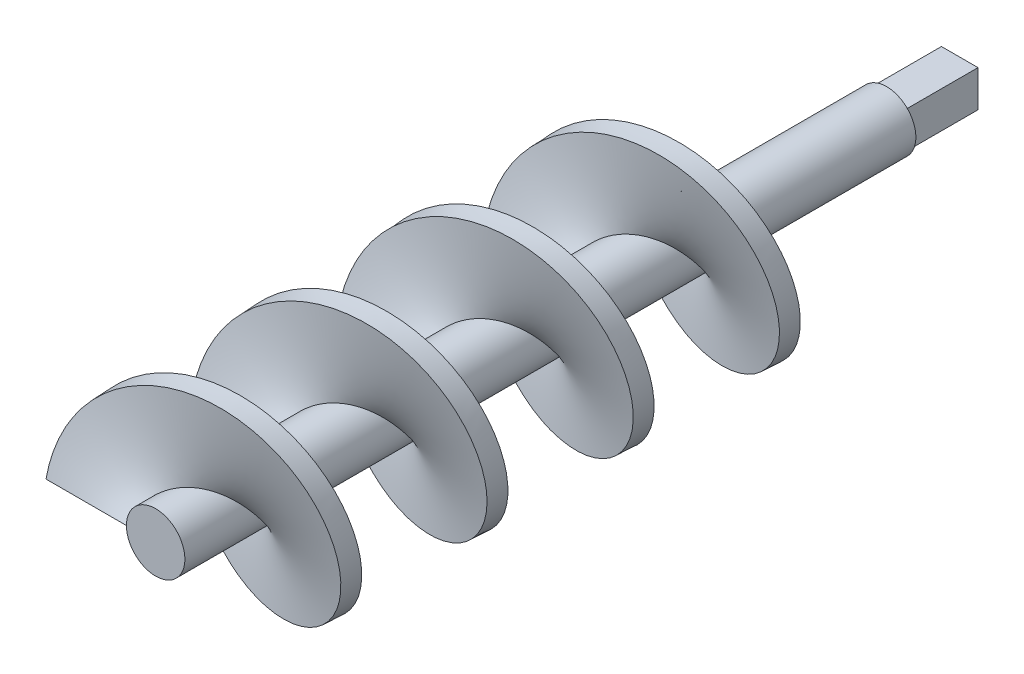
from build123d import *

# Parameters (mm, degrees)
SKETCH1_R           = 2
BOSS_EXTRUDE1_DEPTH = 55
SWEEP1_PITCH        = 10
SWEEP1_HEIGHT       = 40
SWEEP1_RADIUS       = 2
SKETCH8_W           = 5.5
SKETCH8_H           = 1.5
SKETCH9_W           = 4.5
SKETCH9_H           = 4.5
SKETCH9_W_2         = 2.5
SKETCH9_H_2         = 2.5
CUT_EXTRUDE1_DEPTH  = 5


with BuildPart() as part:
    # Sketch1 → Boss-Extrude1 (new body)
    with BuildSketch(Plane.XY):
        Circle(SKETCH1_R)
    extrude(amount=BOSS_EXTRUDE1_DEPTH)

    # Sketch9 → Cut-Extrude1 (cut)
    with BuildSketch(Plane(origin=(0, 0, 0), x_dir=(-1, 0, 0), z_dir=(0, 0, -1))):
        Rectangle(SKETCH9_W, SKETCH9_H)
        Rectangle(SKETCH9_W_2, SKETCH9_H_2, mode=Mode.SUBTRACT)
    extrude(amount=-CUT_EXTRUDE1_DEPTH, mode=Mode.SUBTRACT)


with BuildPart() as body_2:
    # Sweep1: sweep along a helix
    with BuildLine() as sweep1_path:
        Helix(SWEEP1_PITCH, SWEEP1_HEIGHT, SWEEP1_RADIUS, center=(0, 0, 55), direction=(0, 0, -1))
    # Sketch8 → Sweep1 (sweep)
    with BuildSketch(Plane(origin=(-2, 0, 55), x_dir=(-1, 0, 0), z_dir=(-5.205240891921112e-15, 0.782478985826999, -0.6226769922994995))):
        with Locations((2.75, -0.75)):
            Rectangle(SKETCH8_W, SKETCH8_H)
    sweep(path=sweep1_path.line, is_frenet=True)


solid = Compound([part.part, body_2.part])
